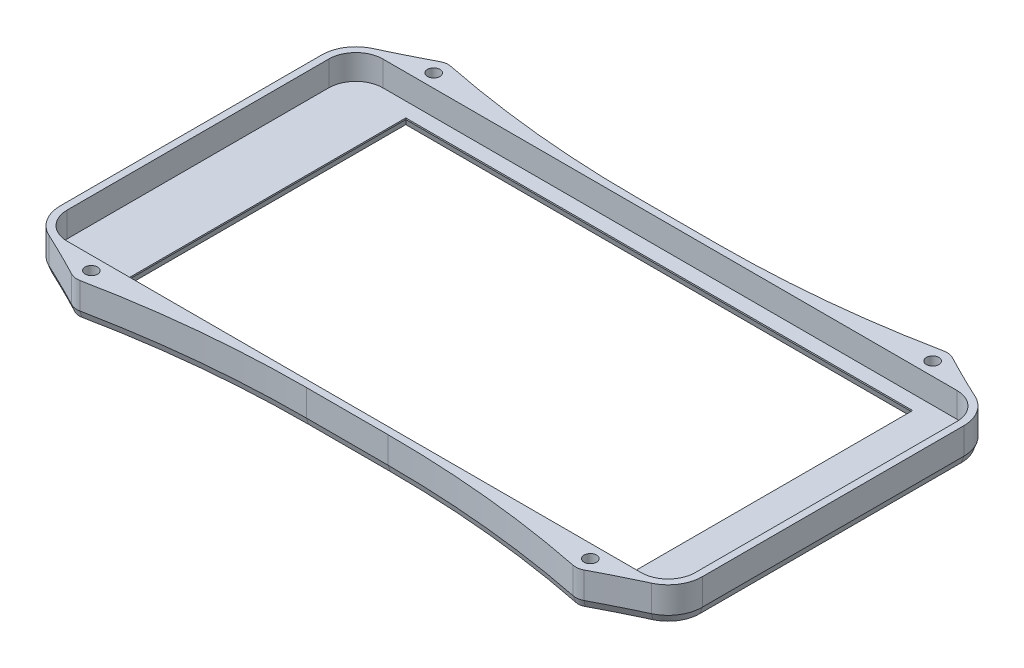
from build123d import *

# Parameters (mm, degrees)
EXTRUDE_1_DEPTH       = 2
EXTRUDE_2_DEPTH       = 8
SKETCH_6_R            = 3.5
SKETCH_6_R_2          = 1.5
EXTRUDE_10_DEPTH      = 8
SKETCH_7_W            = 121.7
SKETCH_7_H            = 68.8
CUT_EXTRUDE_1_DEPTH   = 10
FILLET_1_R            = 250
SKETCH_6_2_R          = 1.5
EXTRUDE_11_DEPTH      = 1.5
CHAMFER_1_SIZE        = 0.6
CHAMFER_1_SIZE2       = 1.648486452
CUT_EXTRUDE_START     = -6
CUT_EXTRUDE_1_2_DEPTH = 6


with BuildPart() as part:
    # 草图1 → 凸台-拉伸1 (new body)
    with BuildSketch(Plane(origin=(0, 0, 0), x_dir=(1, 0, 0), z_dir=(0, 1, 0))):
        with BuildLine():
            Line((6, 0.2), (143.8, 0.2))
            ThreePointArc((143.8, 0.2), (148.184062043, -1.615937957), (150, -6))
            Line((150, -6), (150, -68.8))
            ThreePointArc((150, -68.8), (148.184062043, -73.184062043), (143.8, -75))
            Line((143.8, -75), (6, -75))
            ThreePointArc((6, -75), (1.615937957, -73.184062043), (-0.2, -68.8))
            Line((-0.2, -68.8), (-0.2, -6))
            ThreePointArc((-0.2, -6), (1.615937957, -1.615937957), (6, 0.2))
        make_face()
    extrude(amount=EXTRUDE_1_DEPTH)

    # 草图1<5> → 拉伸-薄壁2 (add)
    with BuildSketch(Plane(origin=(0, 0, 0), x_dir=(1, 0, 0), z_dir=(0, 1, 0))):
        with BuildLine():
            Line((6, 2.2), (143.8, 2.2))
            ThreePointArc((143.8, 2.2), (149.598275606, -0.201724394), (152, -6))
            Line((152, -6), (152, -68.8))
            ThreePointArc((152, -68.8), (149.598275606, -74.598275606), (143.8, -77))
            Line((143.8, -77), (6, -77))
            ThreePointArc((6, -77), (0.201724394, -74.598275606), (-2.2, -68.8))
            Line((-2.2, -68.8), (-2.2, -6))
            ThreePointArc((-2.2, -6), (0.201724394, -0.201724394), (6, 2.2))
        make_face()
        with BuildLine():
            Line((6, 0.2), (143.8, 0.2))
            ThreePointArc((143.8, 0.2), (148.184062043, -1.615937957), (150, -6))
            Line((150, -6), (150, -68.8))
            ThreePointArc((150, -68.8), (148.184062043, -73.184062043), (143.8, -75))
            Line((143.8, -75), (6, -75))
            ThreePointArc((6, -75), (1.615937957, -73.184062043), (-0.2, -68.8))
            Line((-0.2, -68.8), (-0.2, -6))
            ThreePointArc((-0.2, -6), (1.615937957, -1.615937957), (6, 0.2))
        make_face(mode=Mode.SUBTRACT)
    extrude(amount=EXTRUDE_2_DEPTH)

    # 草图6 → 凸台-拉伸10 (add)
    # profile 1 of 4: a face of its own
    with BuildSketch(Plane(origin=(0, 0, 0), x_dir=(1, 0, 0), z_dir=(0, 1, 0))):
        with Locations((15, 3.7)):
            Circle(SKETCH_6_R)
        with Locations(Location((15, 3.7, 0), (0, 0, 90))):
            Circle(SKETCH_6_R_2, mode=Mode.SUBTRACT)
    # profile 2 of 4: a face of its own
    with BuildSketch(Plane(origin=(0, 0, 0), x_dir=(1, 0, 0), z_dir=(0, 1, 0))):
        with Locations((15, -78.5)):
            Circle(SKETCH_6_R)
        with Locations(Location((15, -78.5, 0), (0, 0, 90))):
            Circle(SKETCH_6_R_2, mode=Mode.SUBTRACT)
    # profile 3 of 4: a face of its own
    with BuildSketch(Plane(origin=(0, 0, 0), x_dir=(1, 0, 0), z_dir=(0, 1, 0))):
        with Locations((134.8, 3.7)):
            Circle(SKETCH_6_R)
        with Locations(Location((134.8, 3.7, 0), (0, 0, 90))):
            Circle(SKETCH_6_R_2, mode=Mode.SUBTRACT)
    # profile 4 of 4: a face of its own
    with BuildSketch(Plane(origin=(0, 0, 0), x_dir=(1, 0, 0), z_dir=(0, 1, 0))):
        with Locations((134.8, -78.5)):
            Circle(SKETCH_6_R)
        with Locations(Location((134.8, -78.5, 0), (0, 0, 90))):
            Circle(SKETCH_6_R_2, mode=Mode.SUBTRACT)
    extrude(amount=EXTRUDE_10_DEPTH)

    # 草图7 → Cut-Extrude 1 (cut)
    with BuildSketch(Plane(origin=(0, 0, 0), x_dir=(-1, 0, 0), z_dir=(0, -1, 0))):
        with Locations((-75.85, -37.4)):
            Rectangle(SKETCH_7_W, SKETCH_7_H)
    extrude(amount=-CUT_EXTRUDE_1_DEPTH, mode=Mode.SUBTRACT)

    # 圆角1
    fillet_1_edges = [part.edges().sort_by_distance(p)[0] for p in [
        (18.16227766, 4, 77),
        (11.83772234, 4, 77),
        (137.96227766, 4, 77),
        (131.63772234, 4, 77),
        (131.63772234, 4, -2.2),
        (137.96227766, 4, -2.2),
        (11.83772234, 4, -2.2),
        (18.16227766, 4, -2.2),
    ]]
    fillet(fillet_1_edges, radius=FILLET_1_R)

    # 草图6<2> → 凸台-拉伸11 (add)
    with BuildSketch(Plane(origin=(0, 0, 0), x_dir=(1, 0, 0), z_dir=(0, 1, 0))):
        with Locations(Location((15, 3.7, 0), (0, 0, 90))):
            Circle(SKETCH_6_2_R)
        with Locations(Location((15, -78.5, 0), (0, 0, 90))):
            Circle(SKETCH_6_2_R)
        with Locations(Location((134.8, 3.7, 0), (0, 0, 90))):
            Circle(SKETCH_6_2_R)
        with Locations(Location((134.8, -78.5, 0), (0, 0, 90))):
            Circle(SKETCH_6_2_R)
    extrude(amount=EXTRUDE_11_DEPTH)

    # 倒角1
    chamfer_1_edges = [part.edges().sort_by_distance(p)[0] for p in [
        (136.7, 0, 37.4),
        (75.85, 0, 71.8),
        (15, 0, 37.4),
        (75.85, 0, 3),
        (14.502874151, 0, 81.964515246),
        (74.9, 0, 77),
        (135.297125849, 0, 81.964515246),
        (150.714252509, 0, 73.20830038),
        (135.297125849, 0, -7.164515246),
        (74.9, 0, -2.2),
        (14.502874151, 0, -7.164515246),
        (-0.914252509, 0, 1.59169962),
        (7.988030543, 0, 78.850628869),
        (40.273083878, 0, 78.235796001),
        (141.811969457, 0, 78.850628869),
        (109.526916122, 0, 78.235796001),
        (141.811969457, 0, -4.050628869),
        (109.526916122, 0, -3.435796001),
        (7.988030543, 0, -4.050628869),
        (40.273083878, 0, -3.435796001),
        (-2.2, 0, 37.4),
        (-0.914252509, 0, 73.20830038),
        (152, 0, 37.4),
        (150.714252509, 0, 1.59169962),
    ]]
    chamfer_1_side = [part.faces().sort_by_distance(p)[0] for p in [
        (0.58783664, 0, 72.250617658),
    ]]
    chamfer(chamfer_1_edges, length=CHAMFER_1_SIZE, length2=CHAMFER_1_SIZE2, reference=chamfer_1_side[0])

    # 草图11 → Cut-Extrude 1 2 (cut)
    with BuildSketch(Plane(origin=(0, 8, 0), x_dir=(1, 0, 0), z_dir=(0, 1, 0)).offset(CUT_EXTRUDE_START)):
        with BuildLine():
            Line((143.8, 0.5), (6, 0.5))
            ThreePointArc((6, 0.5), (1.403805922, -1.403805922), (-0.5, -6))
            Line((-0.5, -6), (-0.5, -68.8))
            ThreePointArc((-0.5, -68.8), (1.403805922, -73.396194078), (6, -75.3))
            Line((6, -75.3), (143.8, -75.3))
            ThreePointArc((143.8, -75.3), (148.396194078, -73.396194078), (150.3, -68.8))
            Line((150.3, -68.8), (150.3, -6))
            ThreePointArc((150.3, -6), (148.396194078, -1.403805922), (143.8, 0.5))
        make_face()
        with BuildLine():
            Line((143.8, 0.2), (6, 0.2))
            ThreePointArc((6, 0.2), (1.615937957, -1.615937957), (-0.2, -6))
            Line((-0.2, -6), (-0.2, -68.8))
            ThreePointArc((-0.2, -68.8), (1.615937957, -73.184062043), (6, -75))
            Line((6, -75), (143.8, -75))
            ThreePointArc((143.8, -75), (148.184062043, -73.184062043), (150, -68.8))
            Line((150, -68.8), (150, -6))
            ThreePointArc((150, -6), (148.184062043, -1.615937957), (143.8, 0.2))
        make_face(mode=Mode.SUBTRACT)
    extrude(amount=CUT_EXTRUDE_1_2_DEPTH, mode=Mode.SUBTRACT)


solid = part.part
